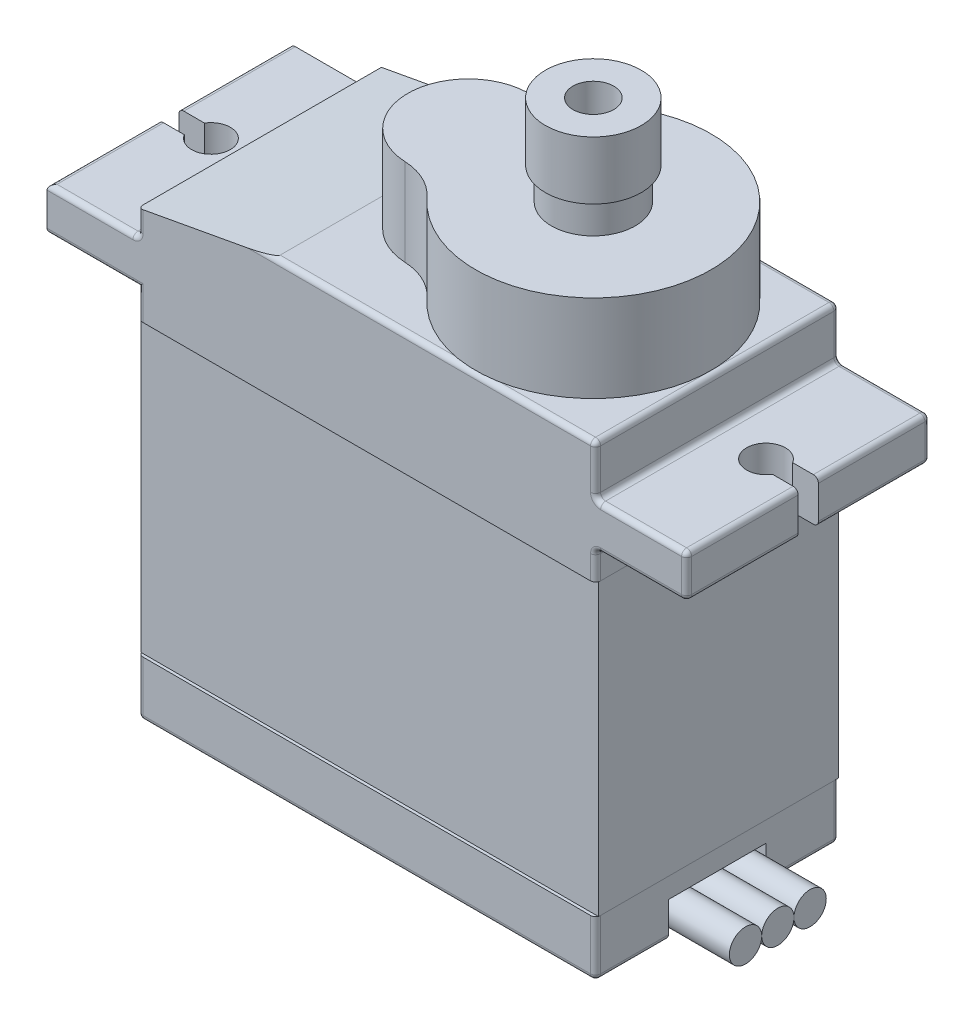
from build123d import *

# Parameters (mm, degrees)
CROQUIS1_W                   = 22.67
CROQUIS1_H                   = 12.06
SALIENTE_EXTRUIR1_DEPTH      = 23.15
CROQUIS2_W                   = 12.06
CROQUIS2_H                   = 2.13
SALIENTE_EXTRUIR2_DEPTH      = 4.51
CROQUIS5_W                   = 12.06
CROQUIS5_H                   = 2.13
SALIENTE_EXTRUIR3_DEPTH      = 4.51
REDONDEO1_R                  = 0.25
CORTAR_EXTRUIR12_DEPTH       = 4.51
SALIENTE_EXTRUIR4_DEPTH      = 4.32
CROQUIS9_R                   = 2.075
SALIENTE_EXTRUIR5_DEPTH      = 1.58
CROQUIS10_R                  = 2.385
SALIENTE_EXTRUIR6_DEPTH      = 2.88
CROQUIS11_R                  = 1.01
CORTAR_EXTRUIR13_DEPTH       = 3.88
CROQUIS12_R                  = 2.385
CROQUIS12_R_2                = 2.375
CORTAR_EXTRUIR14_DEPTH       = 2.88
CORTAR_EXTRUIR15_DEPTH       = 16.88
CROQUIS14_W                  = 22.17
CROQUIS14_H                  = 12.33
CORTAR_EXTRUIR16_DEPTH       = 16.88
CROQUIS16_W                  = 11.56
CROQUIS16_H                  = 14.354716837
CORTAR_EXTRUIR17_DEPTH       = 27.88
CORTAR_EXTRUIR18_DEPTH       = 27.88
CORTAR_EXTRUIR18_DEPTH_BACK  = 27.88
CROQUIS17_W                  = 22.67
CROQUIS17_H                  = 14.354716837
SALIENTE_EXTRUIR7_DEPTH      = 5.88
SALIENTE_EXTRUIR7_DEPTH_BACK = 6
CROQUIS18_W                  = 22.67
CROQUIS18_H                  = 14.354716837
CROQUIS19_W                  = 4.84
CROQUIS19_H                  = 1.754840309
CORTAR_EXTRUIR19_DEPTH       = 1.6
SALIENTE_EXTRUIR8_DEPTH      = 4.6
CROQUIS20_R                  = 0.8
SALIENTE_EXTRUIR8_2_DEPTH    = 4.6
SALIENTE_EXTRUIR8_3_DEPTH    = 4.6


with BuildPart() as part:
    # Croquis1 → Saliente-Extruir1 (new body)
    with BuildSketch(Plane(origin=(0, 0, 0), x_dir=(1, 0, 0), z_dir=(0, 1, 0))):
        Rectangle(CROQUIS1_W, CROQUIS1_H)
    extrude(amount=SALIENTE_EXTRUIR1_DEPTH)

    # Croquis2 → Saliente-Extruir2 (add)
    with BuildSketch(Plane(origin=(11.335, 0, 0), x_dir=(0, 0, -1), z_dir=(1, 0, 0))):
        with Locations((0, 19.595)):
            Rectangle(CROQUIS2_W, CROQUIS2_H)
    extrude(amount=SALIENTE_EXTRUIR2_DEPTH)

    # Croquis5 → Saliente-Extruir3 (add)
    with BuildSketch(Plane.ZY.offset(11.335)):
        with Locations((0, 19.595)):
            Rectangle(CROQUIS5_W, CROQUIS5_H)
    extrude(amount=SALIENTE_EXTRUIR3_DEPTH)

    # Redondeo1
    redondeo1_edges = [part.edges().sort_by_distance(p)[0] for p in [
        (-11.335, 21.905, 6.03),
        (11.335, 9.265, 6.03),
        (11.335, 21.905, 6.03),
        (11.335, 21.905, -6.03),
        (11.335, 9.265, -6.03),
        (11.335, 0, 0),
        (0, 0, -6.03),
        (0, 0, 6.03),
        (-11.335, 0, 0),
        (-11.335, 9.265, -6.03),
        (-11.335, 9.265, 6.03),
        (-13.59, 18.53, 6.03),
        (-13.59, 20.66, 6.03),
        (0, 23.15, -6.03),
        (0, 23.15, 6.03),
        (-11.335, 20.66, 0),
        (-11.335, 23.15, 0),
        (11.335, 23.15, 0),
        (13.59, 18.53, 6.03),
        (13.59, 20.66, 6.03),
        (13.59, 20.66, -6.03),
        (13.59, 18.53, -6.03),
        (11.335, 18.53, 0),
        (11.335, 20.66, 0),
        (15.845, 19.595, -6.03),
        (15.845, 19.595, 6.03),
        (15.845, 18.53, 0),
        (15.845, 20.66, 0),
        (-15.845, 18.53, 0),
        (-15.845, 20.66, 0),
    ]]
    fillet(redondeo1_edges, radius=REDONDEO1_R)

    # Croquis6 → Cortar-Extruir12 (cut)
    with BuildSketch(Plane(origin=(0, 20.66, 0), x_dir=(1, 0, 0), z_dir=(0, 1, 0))):
        with BuildLine():
            Line((-14.56951205, 0.5), (-16.56951205, 0.5))
            Line((-16.56951205, 0.5), (-16.56951205, -0.5))
            Line((-16.56951205, -0.5), (-14.56951205, -0.5))
            ThreePointArc((-14.56951205, -0.5), (-12.79, 0), (-14.56951205, 0.5))
        make_face()
        with BuildLine():
            Line((14.56951205, 0.5), (16.56951205, 0.5))
            Line((16.56951205, 0.5), (16.56951205, -0.5))
            Line((16.56951205, -0.5), (14.56951205, -0.5))
            ThreePointArc((14.56951205, -0.5), (12.79, 0), (14.56951205, 0.5))
        make_face()
    extrude(amount=-CORTAR_EXTRUIR12_DEPTH, mode=Mode.SUBTRACT)

    # Croquis13 → Cortar-Extruir15 (cut)
    with BuildSketch(Plane.XY.offset(6.03)):
        Polygon((-4.540532383, 23.15), (-11.335, 21.905), (-11.335, 23.15), align=None)
    extrude(amount=-CORTAR_EXTRUIR15_DEPTH, mode=Mode.SUBTRACT)

    # Croquis14 → Cortar-Extruir16 (cut)
    with BuildSketch(Plane.XY.offset(6.03)):
        with Locations((0, 8.935)):
            Rectangle(CROQUIS14_W, CROQUIS14_H)
    extrude(amount=-CORTAR_EXTRUIR16_DEPTH, mode=Mode.SUBTRACT)

    # Croquis16 → Cortar-Extruir17 (cut)
    with BuildSketch(Plane.ZY.offset(11.335)):
        with Locations((0, 9.932198727)):
            Rectangle(CROQUIS16_W, CROQUIS16_H)
    extrude(amount=-CORTAR_EXTRUIR17_DEPTH, mode=Mode.SUBTRACT)

    # Croquis17 → Cortar-Extruir18 (cut, two sides: drawn at the far end of the back side and taken through both)
    with BuildSketch(Plane.XY.offset(-CORTAR_EXTRUIR18_DEPTH_BACK)):
        with Locations((0, 9.932198727)):
            Rectangle(CROQUIS17_W, CROQUIS17_H)
    extrude(amount=CORTAR_EXTRUIR18_DEPTH + CORTAR_EXTRUIR18_DEPTH_BACK, mode=Mode.SUBTRACT)


with BuildPart() as body_2:
    # Croquis8 → Saliente-Extruir4 (new body)
    with BuildSketch(Plane(origin=(0, 23.15, 0), x_dir=(1, 0, 0), z_dir=(0, 1, 0))):
        with BuildLine():
            ThreePointArc((0.929343711, -3.976626478), (11.084774082, -0.106346012), (0.999028124, 3.942056806))
            ThreePointArc((0.999028124, 3.942056806), (0.046671675, 3.262297983), (-1.093280765, 2.998549432))
            ThreePointArc((-1.093280765, 2.998549432), (-3.999883847, 0.026398978), (-1.146036702, -2.996443439))
            ThreePointArc((-1.146036702, -2.996443439), (-0.01090242, -3.280212753), (0.929343711, -3.976626478))
        make_face()
    extrude(amount=SALIENTE_EXTRUIR4_DEPTH)


with BuildPart() as body_3:
    # Croquis9 → Saliente-Extruir5 (new body)
    with BuildSketch(Plane(origin=(0, 27.47, 0), x_dir=(1, 0, 0), z_dir=(0, 1, 0))):
        with Locations((5.25, -0.055)):
            Circle(CROQUIS9_R)
    extrude(amount=SALIENTE_EXTRUIR5_DEPTH)


with BuildPart() as body_4:
    # Croquis10 → Saliente-Extruir6 (new body)
    with BuildSketch(Plane(origin=(0, 29.05, 0), x_dir=(1, 0, 0), z_dir=(0, 1, 0))):
        with Locations((5.25, -0.055)):
            Circle(CROQUIS10_R)
    extrude(amount=SALIENTE_EXTRUIR6_DEPTH)


with BuildPart() as cortar_extruir13_tool:
    # Croquis11 → Cortar-Extruir13 (new body)
    with BuildSketch(Plane(origin=(0, 31.93, 0), x_dir=(1, 0, 0), z_dir=(0, 1, 0))):
        with Locations((5.25, -0.055)):
            Circle(CROQUIS11_R)
    extrude(amount=-CORTAR_EXTRUIR13_DEPTH)


with BuildPart() as body_3_1:
    add(body_3.part)

    # Cortar-Extruir13: cut by cortar_extruir13_tool
    add(cortar_extruir13_tool.part, mode=Mode.SUBTRACT)


with BuildPart() as body_4_1:
    add(body_4.part)

    # Cortar-Extruir13: cut by cortar_extruir13_tool
    add(cortar_extruir13_tool.part, mode=Mode.SUBTRACT)

    # Croquis12 → Cortar-Extruir14 (cut)
    with BuildSketch(Plane(origin=(0, 31.93, 0), x_dir=(1, 0, 0), z_dir=(0, 1, 0))):
        with Locations((5.25, -0.055)):
            Circle(CROQUIS12_R)
        with Locations((5.25, -0.055)):
            Circle(CROQUIS12_R_2, mode=Mode.SUBTRACT)
    extrude(amount=-CORTAR_EXTRUIR14_DEPTH, mode=Mode.SUBTRACT)


with BuildPart() as cortar_extruir18_piece_1:
    # of the separate pieces the step leaves, piece 1, a body of its own (cortar_extruir18_pieces)
    add(part.part.solids().sort_by_distance((-11.085, 17.109557146, -6.03))[0])


with BuildPart() as cortar_extruir18_piece_2:
    # of the separate pieces the step leaves, piece 2, a body of its own (cortar_extruir18_pieces)
    add(part.part.solids().sort_by_distance((11.085, 0.25, -6.03))[0])

    # Croquis19 → Cortar-Extruir19 (cut)
    with BuildSketch(Plane(origin=(11.335, 0, 0), x_dir=(0, 0, -1), z_dir=(1, 0, 0))):
        with Locations((0, 0.877420155)):
            Rectangle(CROQUIS19_W, CROQUIS19_H)
    extrude(amount=-CORTAR_EXTRUIR19_DEPTH, mode=Mode.SUBTRACT)


with BuildPart() as body_6:
    # Croquis18 → Saliente-Extruir7 (new, two sides: drawn at the far end of the back side and taken through both)
    with BuildSketch(Plane.XY.offset(-SALIENTE_EXTRUIR7_DEPTH_BACK)):
        with Locations((0, 9.932198727)):
            Rectangle(CROQUIS18_W, CROQUIS18_H)
    extrude(amount=SALIENTE_EXTRUIR7_DEPTH + SALIENTE_EXTRUIR7_DEPTH_BACK)


with BuildPart() as body_7:
    # Croquis20 → Saliente-Extruir8 (new body)
    with BuildSketch(Plane(origin=(9.735, 0, 0), x_dir=(0, 0, -1), z_dir=(1, 0, 0))):
        with BuildLine():
            ThreePointArc((-0.8, 0.877420155), (0, 0.077420155), (0.8, 0.877420155))
            ThreePointArc((0.8, 0.877420155), (0, 1.677420155), (-0.8, 0.877420155))
        make_face()
    extrude(amount=SALIENTE_EXTRUIR8_DEPTH)


with BuildPart() as body_8:
    # Croquis20 → Saliente-Extruir8 2 (new body)
    with BuildSketch(Plane(origin=(9.735, 0, 0), x_dir=(0, 0, -1), z_dir=(1, 0, 0))):
        with Locations((-1.6, 0.877420155)):
            Circle(CROQUIS20_R)
    extrude(amount=SALIENTE_EXTRUIR8_2_DEPTH)


with BuildPart() as body_9:
    # Croquis20 → Saliente-Extruir8 3 (new body)
    with BuildSketch(Plane(origin=(9.735, 0, 0), x_dir=(0, 0, -1), z_dir=(1, 0, 0))):
        with Locations((1.6, 0.877420155)):
            Circle(CROQUIS20_R)
    extrude(amount=SALIENTE_EXTRUIR8_3_DEPTH)


solid = Compound([body_2.part, body_3_1.part, body_4_1.part, cortar_extruir18_piece_1.part, cortar_extruir18_piece_2.part, body_6.part, body_7.part, body_8.part, body_9.part])
